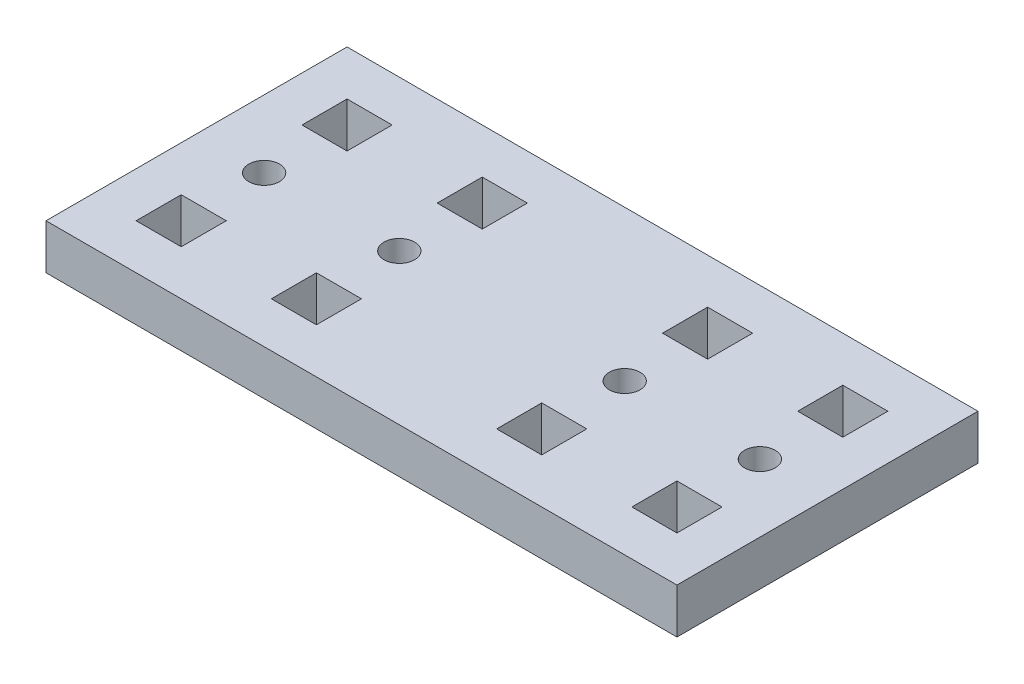
from build123d import *

# Parameters (mm, degrees)
ELEVATOR_SPACER_W   = 88.9
ELEVATOR_SPACER_H   = 42.418
ELEVATOR_SPACER_R   = 2.159
ELEVATOR_SPACER_W_2 = 6.35
ELEVATOR_SPACER_H_2 = 6.35
BOSS_EXTRUDE1_DEPTH = 6.35


with BuildPart() as part:
    # Elevator Spacer → Boss-Extrude1 (new body)
    with BuildSketch(Plane(origin=(0, 0, 0), x_dir=(1, 0, 0), z_dir=(0, 1, 0))):
        Rectangle(ELEVATOR_SPACER_W, ELEVATOR_SPACER_H)
        with Locations(Location((34.925, 0, 0), (0, 0, 270))):
            Circle(ELEVATOR_SPACER_R, mode=Mode.SUBTRACT)
        with Locations(Location((15.875, 0, 0), (0, 0, 270))):
            Circle(ELEVATOR_SPACER_R, mode=Mode.SUBTRACT)
        with Locations(Location((-15.875, 0, 0), (0, 0, 90))):
            Circle(ELEVATOR_SPACER_R, mode=Mode.SUBTRACT)
        with Locations(Location((-34.925, 0, 0), (0, 0, 90))):
            Circle(ELEVATOR_SPACER_R, mode=Mode.SUBTRACT)
        with Locations((34.925, 11.684)):
            Rectangle(ELEVATOR_SPACER_W_2, ELEVATOR_SPACER_H_2, mode=Mode.SUBTRACT)
        with Locations((34.925, -11.684)):
            Rectangle(ELEVATOR_SPACER_W_2, ELEVATOR_SPACER_H_2, mode=Mode.SUBTRACT)
        with Locations((15.875, 11.684)):
            Rectangle(ELEVATOR_SPACER_W_2, ELEVATOR_SPACER_H_2, mode=Mode.SUBTRACT)
        with Locations((15.875, -11.684)):
            Rectangle(ELEVATOR_SPACER_W_2, ELEVATOR_SPACER_H_2, mode=Mode.SUBTRACT)
        with Locations((-15.875, -11.684)):
            Rectangle(ELEVATOR_SPACER_W_2, ELEVATOR_SPACER_H_2, mode=Mode.SUBTRACT)
        with Locations((-15.875, 11.684)):
            Rectangle(ELEVATOR_SPACER_W_2, ELEVATOR_SPACER_H_2, mode=Mode.SUBTRACT)
        with Locations((-34.925, -11.684)):
            Rectangle(ELEVATOR_SPACER_W_2, ELEVATOR_SPACER_H_2, mode=Mode.SUBTRACT)
        with Locations((-34.925, 11.684)):
            Rectangle(ELEVATOR_SPACER_W_2, ELEVATOR_SPACER_H_2, mode=Mode.SUBTRACT)
    extrude(amount=BOSS_EXTRUDE1_DEPTH)


solid = part.part
